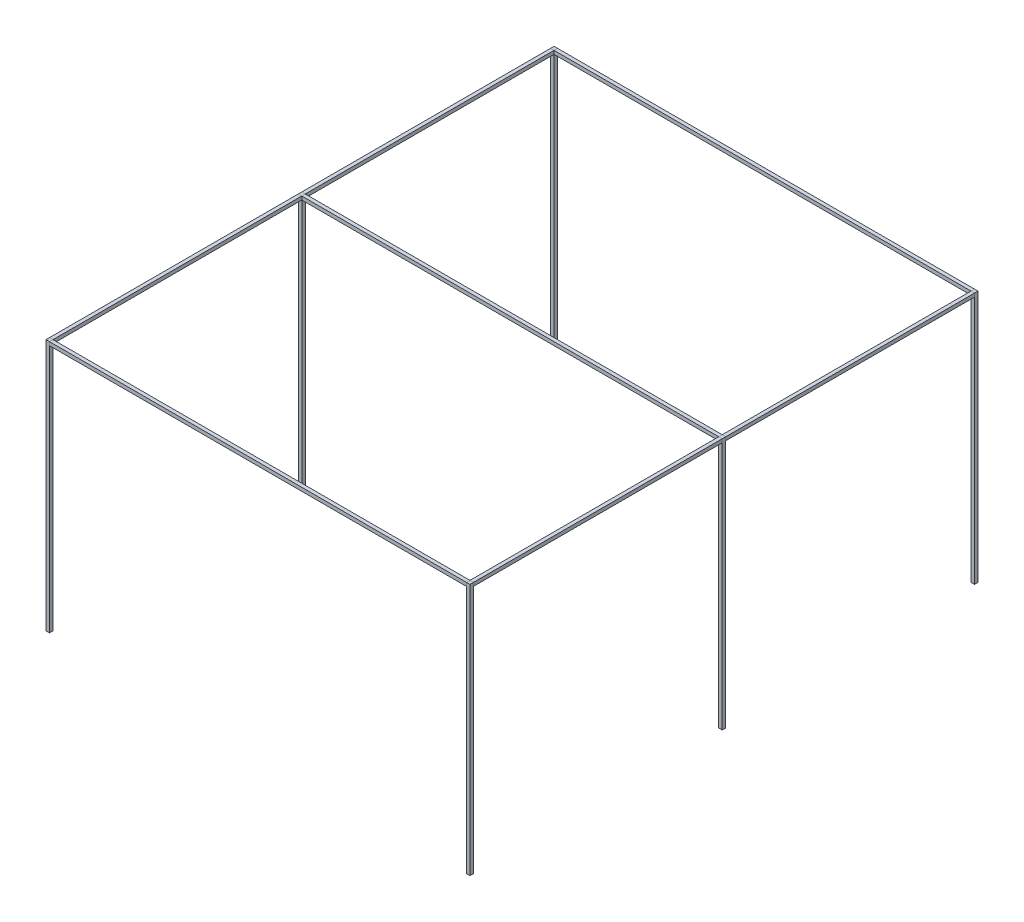
from build123d import *

# Parameters (mm, degrees)
SKETCH1_W             = 25.4
SKETCH1_H             = 25.4
BOSS_EXTRUDE1_DEPTH   = 1828.8
BOSS_EXTRUDE1_2_DEPTH = 1828.8
BOSS_EXTRUDE1_3_DEPTH = 1828.8
BOSS_EXTRUDE1_4_DEPTH = 1828.8
BOSS_EXTRUDE1_5_DEPTH = 1828.8
BOSS_EXTRUDE1_6_DEPTH = 1828.8
SKETCH2_W             = 25.4
SKETCH2_H             = 25.4
BOSS_EXTRUDE2_DEPTH   = 1803.4
BOSS_EXTRUDE2_2_DEPTH = 1803.4
SKETCH3_W             = 25.4
SKETCH3_H             = 25.4
BOSS_EXTRUDE3_DEPTH   = 1803.4
BOSS_EXTRUDE3_2_DEPTH = 1803.4
SKETCH4_W             = 25.4
SKETCH4_H             = 25.4
BOSS_EXTRUDE4_DEPTH   = 3022.6
BOSS_EXTRUDE4_2_DEPTH = 3022.6
BOSS_EXTRUDE4_3_DEPTH = 3022.6


with BuildPart() as part:
    # Sketch1 → Boss-Extrude1 (new body)
    with BuildSketch(Plane(origin=(0, 0, 0), x_dir=(1, 0, 0), z_dir=(0, 1, 0))):
        Rectangle(SKETCH1_W, SKETCH1_H)
    extrude(amount=BOSS_EXTRUDE1_DEPTH)


with BuildPart() as body_2:
    # Sketch1 → Boss-Extrude1 2 (new body)
    with BuildSketch(Plane(origin=(0, 0, 0), x_dir=(1, 0, 0), z_dir=(0, 1, 0))):
        with Locations((3048, -1828.8)):
            Rectangle(SKETCH1_W, SKETCH1_H)
    extrude(amount=BOSS_EXTRUDE1_2_DEPTH)


with BuildPart() as body_3:
    # Sketch1 → Boss-Extrude1 3 (new body)
    with BuildSketch(Plane(origin=(0, 0, 0), x_dir=(1, 0, 0), z_dir=(0, 1, 0))):
        with Locations((0, -1828.8)):
            Rectangle(SKETCH1_W, SKETCH1_H)
    extrude(amount=BOSS_EXTRUDE1_3_DEPTH)


with BuildPart() as body_4:
    # Sketch1 → Boss-Extrude1 4 (new body)
    with BuildSketch(Plane(origin=(0, 0, 0), x_dir=(1, 0, 0), z_dir=(0, 1, 0))):
        with Locations((0, -3657.6)):
            Rectangle(SKETCH1_W, SKETCH1_H)
    extrude(amount=BOSS_EXTRUDE1_4_DEPTH)


with BuildPart() as body_5:
    # Sketch1 → Boss-Extrude1 5 (new body)
    with BuildSketch(Plane(origin=(0, 0, 0), x_dir=(1, 0, 0), z_dir=(0, 1, 0))):
        with Locations((3048, -3657.6)):
            Rectangle(SKETCH1_W, SKETCH1_H)
    extrude(amount=BOSS_EXTRUDE1_5_DEPTH)


with BuildPart() as body_6:
    # Sketch1 → Boss-Extrude1 6 (new body)
    with BuildSketch(Plane(origin=(0, 0, 0), x_dir=(1, 0, 0), z_dir=(0, 1, 0))):
        with Locations((3048, 0)):
            Rectangle(SKETCH1_W, SKETCH1_H)
    extrude(amount=BOSS_EXTRUDE1_6_DEPTH)


with BuildPart() as body_7:
    # Sketch2 → Boss-Extrude2 (new body)
    with BuildSketch(Plane.XY.offset(12.7)):
        with Locations((0, 1816.1)):
            Rectangle(SKETCH2_W, SKETCH2_H)
    extrude(amount=BOSS_EXTRUDE2_DEPTH)


with BuildPart() as body_8:
    # Sketch2 → Boss-Extrude2 2 (new body)
    with BuildSketch(Plane.XY.offset(12.7)):
        with Locations((3048, 1816.1)):
            Rectangle(SKETCH2_W, SKETCH2_H)
    extrude(amount=BOSS_EXTRUDE2_2_DEPTH)


with BuildPart() as body_9:
    # Sketch3 → Boss-Extrude3 (new body)
    with BuildSketch(Plane.XY.offset(1841.5)):
        with Locations((0, 1816.1)):
            Rectangle(SKETCH3_W, SKETCH3_H)
    extrude(amount=BOSS_EXTRUDE3_DEPTH)


with BuildPart() as body_10:
    # Sketch3 → Boss-Extrude3 2 (new body)
    with BuildSketch(Plane.XY.offset(1841.5)):
        with Locations((3048, 1816.1)):
            Rectangle(SKETCH3_W, SKETCH3_H)
    extrude(amount=BOSS_EXTRUDE3_2_DEPTH)


with BuildPart() as body_11:
    # Sketch4 → Boss-Extrude4 (new body)
    with BuildSketch(Plane.ZY.offset(-3035.3)):
        with Locations((0, 1816.1)):
            Rectangle(SKETCH4_W, SKETCH4_H)
    extrude(amount=BOSS_EXTRUDE4_DEPTH)


with BuildPart() as body_12:
    # Sketch4 → Boss-Extrude4 2 (new body)
    with BuildSketch(Plane.ZY.offset(-3035.3)):
        with Locations((1828.8, 1816.1)):
            Rectangle(SKETCH4_W, SKETCH4_H)
    extrude(amount=BOSS_EXTRUDE4_2_DEPTH)


with BuildPart() as body_13:
    # Sketch4 → Boss-Extrude4 3 (new body)
    with BuildSketch(Plane.ZY.offset(-3035.3)):
        with Locations((3657.6, 1816.1)):
            Rectangle(SKETCH4_W, SKETCH4_H)
    extrude(amount=BOSS_EXTRUDE4_3_DEPTH)


solid = Compound([part.part, body_2.part, body_3.part, body_4.part, body_5.part, body_6.part, body_7.part, body_8.part, body_9.part, body_10.part, body_11.part, body_12.part, body_13.part])
